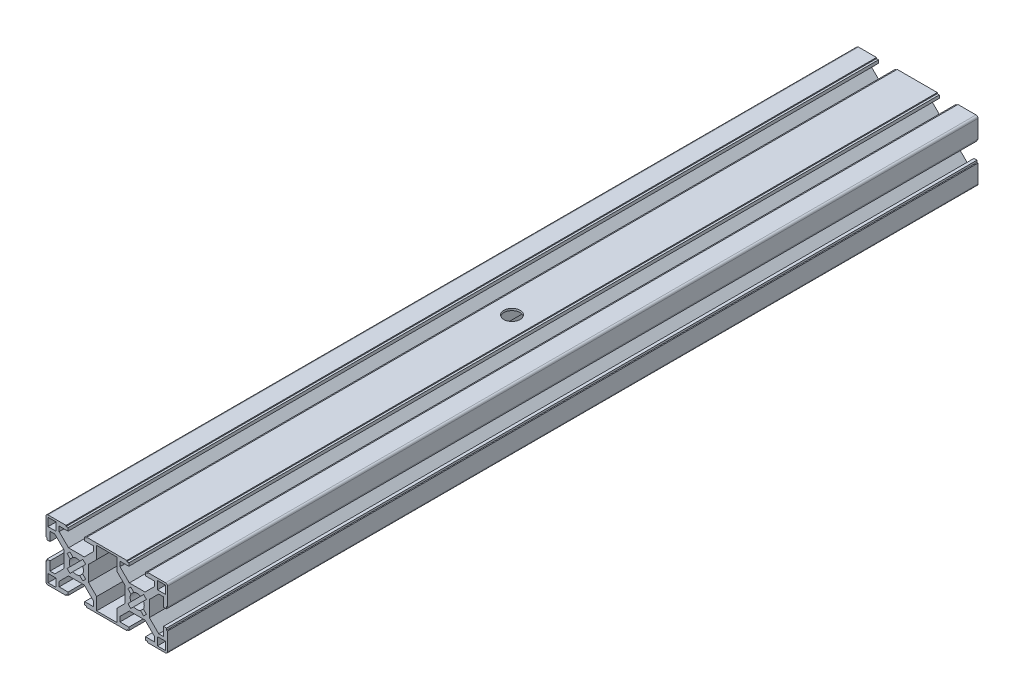
from build123d import *

# Parameters (mm, degrees)
ESBO_O1_W                      = 4
ESBO_O1_H                      = 4
RESSALTO_EXTRUS_O1_DEPTH       = 400
PADR_OCIRCULAR1_COUNT          = 4
PADR_O_LINEAR1_COUNT           = 2
PADR_O_LINEAR1_PITCH           = 30
PADR_O_LINEAR1_COPY_1_SKETCH_W = 4
PADR_O_LINEAR1_COPY_1_SKETCH_H = 4
PADR_O_LINEAR1_COPY_1_DEPTH    = 400
PADR_O_LINEAR1_COPY_2_SKETCH_W = 4
PADR_O_LINEAR1_COPY_2_SKETCH_H = 4
PADR_O_LINEAR1_COPY_2_DEPTH    = 400
PADR_O_LINEAR1_COPY_3_SKETCH_W = 4
PADR_O_LINEAR1_COPY_3_SKETCH_H = 4
PADR_O_LINEAR1_COPY_3_DEPTH    = 400
ESBO_O4_W                      = 10
ESBO_O4_H                      = 28
CORTE_EXTRUS_O1_DEPTH          = 403.802681222
FILETE1_R                      = 1
ESBO_O5_R                      = 4
CORTE_EXTRUS_O2_DEPTH          = 404.639690813


with BuildPart() as part:
    # Esboço1 → Ressalto-extrusão1 (new body)
    with BuildSketch(Plane.XY):
        with BuildLine():
            ThreePointArc((-1.664601464, 3.078815026), (-0.858529967, 3.393070335), (0, 3.5))
            Line((0, 3.5), (0, 6))
            Line((0, 6), (-3.878679656, 6))
            Line((-3.878679656, 6), (-8.5, 10.621320344))
            Line((-8.5, 10.621320344), (-8.5, 13))
            Line((-8.5, 13), (-4.1, 13))
            Line((-4.1, 13), (-4.1, 14.5))
            Line((-4.1, 14.5), (-5.1, 14.5))
            Line((-5.1, 14.5), (-5.1, 15))
            Line((-5.1, 15), (-15, 15))
            Line((-15, 15), (-15, 5.1))
            Line((-15, 5.1), (-14.5, 5.1))
            Line((-14.5, 5.1), (-14.5, 4.1))
            Line((-14.5, 4.1), (-13, 4.1))
            Line((-13, 4.1), (-13, 8.5))
            Line((-13, 8.5), (-10.621320344, 8.5))
            Line((-10.621320344, 8.5), (-6, 3.878679656))
            Line((-6, 3.878679656), (-6, 0))
            Line((-6, 0), (-3.5, 0))
            ThreePointArc((-3.5, 0), (-3.393070335, 0.858529967), (-3.078815026, 1.664601464))
            Line((-3.078815026, 1.664601464), (-4.596194078, 3.181980515))
            Line((-4.596194078, 3.181980515), (-3.181980515, 4.596194078))
            Line((-3.181980515, 4.596194078), (-1.664601464, 3.078815026))
        make_face()
        with Locations((-12, 12)):
            Rectangle(ESBO_O1_W, ESBO_O1_H, mode=Mode.SUBTRACT)
    ressalto_extrus_o1 = extrude(amount=RESSALTO_EXTRUS_O1_DEPTH)

    # PadrãoCircular1: Ressalto-extrusão1 ×4 about axis
    padr_ocircular1_axis = Axis((0, 0, 0), (0, 0, 1))
    for i in range(1, PADR_OCIRCULAR1_COUNT):
        add(ressalto_extrus_o1.rotate(padr_ocircular1_axis, i * 360 / PADR_OCIRCULAR1_COUNT))

    # Padrão linear1: Ressalto-extrusão1 ×2
    with Locations(*[(i * PADR_O_LINEAR1_PITCH, 0, 0) for i in range(1, PADR_O_LINEAR1_COUNT)]):
        add(ressalto_extrus_o1)

    # Padrão linear1 copy 1 sketch → Padrão linear1 copy 1 (add)
    with BuildSketch(Plane(origin=(30, 0, 0), x_dir=(0, 1, 0), z_dir=(0, 0, 1))):
        with BuildLine():
            ThreePointArc((-1.664601464, 3.078815026), (-0.858529967, 3.393070335), (0, 3.5))
            Line((0, 3.5), (0, 6))
            Line((0, 6), (-3.878679656, 6))
            Line((-3.878679656, 6), (-8.5, 10.621320344))
            Line((-8.5, 10.621320344), (-8.5, 13))
            Line((-8.5, 13), (-4.1, 13))
            Line((-4.1, 13), (-4.1, 14.5))
            Line((-4.1, 14.5), (-5.1, 14.5))
            Line((-5.1, 14.5), (-5.1, 15))
            Line((-5.1, 15), (-15, 15))
            Line((-15, 15), (-15, 5.1))
            Line((-15, 5.1), (-14.5, 5.1))
            Line((-14.5, 5.1), (-14.5, 4.1))
            Line((-14.5, 4.1), (-13, 4.1))
            Line((-13, 4.1), (-13, 8.5))
            Line((-13, 8.5), (-10.621320344, 8.5))
            Line((-10.621320344, 8.5), (-6, 3.878679656))
            Line((-6, 3.878679656), (-6, 0))
            Line((-6, 0), (-3.5, 0))
            ThreePointArc((-3.5, 0), (-3.393070335, 0.858529967), (-3.078815026, 1.664601464))
            Line((-3.078815026, 1.664601464), (-4.596194078, 3.181980515))
            Line((-4.596194078, 3.181980515), (-3.181980515, 4.596194078))
            Line((-3.181980515, 4.596194078), (-1.664601464, 3.078815026))
        make_face()
        with Locations((-12, 12)):
            Rectangle(PADR_O_LINEAR1_COPY_1_SKETCH_W, PADR_O_LINEAR1_COPY_1_SKETCH_H, mode=Mode.SUBTRACT)
    extrude(amount=PADR_O_LINEAR1_COPY_1_DEPTH)

    # Padrão linear1 copy 2 sketch → Padrão linear1 copy 2 (add)
    with BuildSketch(Plane(origin=(30, 0, 0), x_dir=(-1, 0, 0), z_dir=(0, 0, 1))):
        with BuildLine():
            ThreePointArc((-1.664601464, 3.078815026), (-0.858529967, 3.393070335), (0, 3.5))
            Line((0, 3.5), (0, 6))
            Line((0, 6), (-3.878679656, 6))
            Line((-3.878679656, 6), (-8.5, 10.621320344))
            Line((-8.5, 10.621320344), (-8.5, 13))
            Line((-8.5, 13), (-4.1, 13))
            Line((-4.1, 13), (-4.1, 14.5))
            Line((-4.1, 14.5), (-5.1, 14.5))
            Line((-5.1, 14.5), (-5.1, 15))
            Line((-5.1, 15), (-15, 15))
            Line((-15, 15), (-15, 5.1))
            Line((-15, 5.1), (-14.5, 5.1))
            Line((-14.5, 5.1), (-14.5, 4.1))
            Line((-14.5, 4.1), (-13, 4.1))
            Line((-13, 4.1), (-13, 8.5))
            Line((-13, 8.5), (-10.621320344, 8.5))
            Line((-10.621320344, 8.5), (-6, 3.878679656))
            Line((-6, 3.878679656), (-6, 0))
            Line((-6, 0), (-3.5, 0))
            ThreePointArc((-3.5, 0), (-3.393070335, 0.858529967), (-3.078815026, 1.664601464))
            Line((-3.078815026, 1.664601464), (-4.596194078, 3.181980515))
            Line((-4.596194078, 3.181980515), (-3.181980515, 4.596194078))
            Line((-3.181980515, 4.596194078), (-1.664601464, 3.078815026))
        make_face()
        with Locations((-12, 12)):
            Rectangle(PADR_O_LINEAR1_COPY_2_SKETCH_W, PADR_O_LINEAR1_COPY_2_SKETCH_H, mode=Mode.SUBTRACT)
    extrude(amount=PADR_O_LINEAR1_COPY_2_DEPTH)

    # Padrão linear1 copy 3 sketch → Padrão linear1 copy 3 (add)
    with BuildSketch(Plane(origin=(30, 0, 0), x_dir=(0, -1, 0), z_dir=(0, 0, 1))):
        with BuildLine():
            ThreePointArc((-1.664601464, 3.078815026), (-0.858529967, 3.393070335), (0, 3.5))
            Line((0, 3.5), (0, 6))
            Line((0, 6), (-3.878679656, 6))
            Line((-3.878679656, 6), (-8.5, 10.621320344))
            Line((-8.5, 10.621320344), (-8.5, 13))
            Line((-8.5, 13), (-4.1, 13))
            Line((-4.1, 13), (-4.1, 14.5))
            Line((-4.1, 14.5), (-5.1, 14.5))
            Line((-5.1, 14.5), (-5.1, 15))
            Line((-5.1, 15), (-15, 15))
            Line((-15, 15), (-15, 5.1))
            Line((-15, 5.1), (-14.5, 5.1))
            Line((-14.5, 5.1), (-14.5, 4.1))
            Line((-14.5, 4.1), (-13, 4.1))
            Line((-13, 4.1), (-13, 8.5))
            Line((-13, 8.5), (-10.621320344, 8.5))
            Line((-10.621320344, 8.5), (-6, 3.878679656))
            Line((-6, 3.878679656), (-6, 0))
            Line((-6, 0), (-3.5, 0))
            ThreePointArc((-3.5, 0), (-3.393070335, 0.858529967), (-3.078815026, 1.664601464))
            Line((-3.078815026, 1.664601464), (-4.596194078, 3.181980515))
            Line((-4.596194078, 3.181980515), (-3.181980515, 4.596194078))
            Line((-3.181980515, 4.596194078), (-1.664601464, 3.078815026))
        make_face()
        with Locations((-12, 12)):
            Rectangle(PADR_O_LINEAR1_COPY_3_SKETCH_W, PADR_O_LINEAR1_COPY_3_SKETCH_H, mode=Mode.SUBTRACT)
    extrude(amount=PADR_O_LINEAR1_COPY_3_DEPTH)

    # Esboço4 → Corte-extrusão1 (cut, through all)
    with BuildSketch(Plane(origin=(0, 0, 0), x_dir=(-1, 0, 0), z_dir=(0, 0, -1))):
        with Locations((-15, 0)):
            Rectangle(ESBO_O4_W, ESBO_O4_H)
    extrude(amount=-CORTE_EXTRUS_O1_DEPTH, mode=Mode.SUBTRACT)

    # Filete1
    filete1_edges = [part.edges().sort_by_distance(p)[0] for p in [
        (45, -15, 200),
        (45, 15, 200),
        (-15, 15, 200),
        (-15, -15, 200),
    ]]
    fillet(filete1_edges, radius=FILETE1_R)

    # Esboço5 → Corte-extrusão2 (cut, through all)
    with BuildSketch(Plane(origin=(0, 15, 0), x_dir=(1, 0, 0), z_dir=(0, 1, 0))):
        with Locations(Location((15, -200, 0), (0, 0, 180))):
            Circle(ESBO_O5_R)
    extrude(amount=-CORTE_EXTRUS_O2_DEPTH, mode=Mode.SUBTRACT)


solid = part.part
